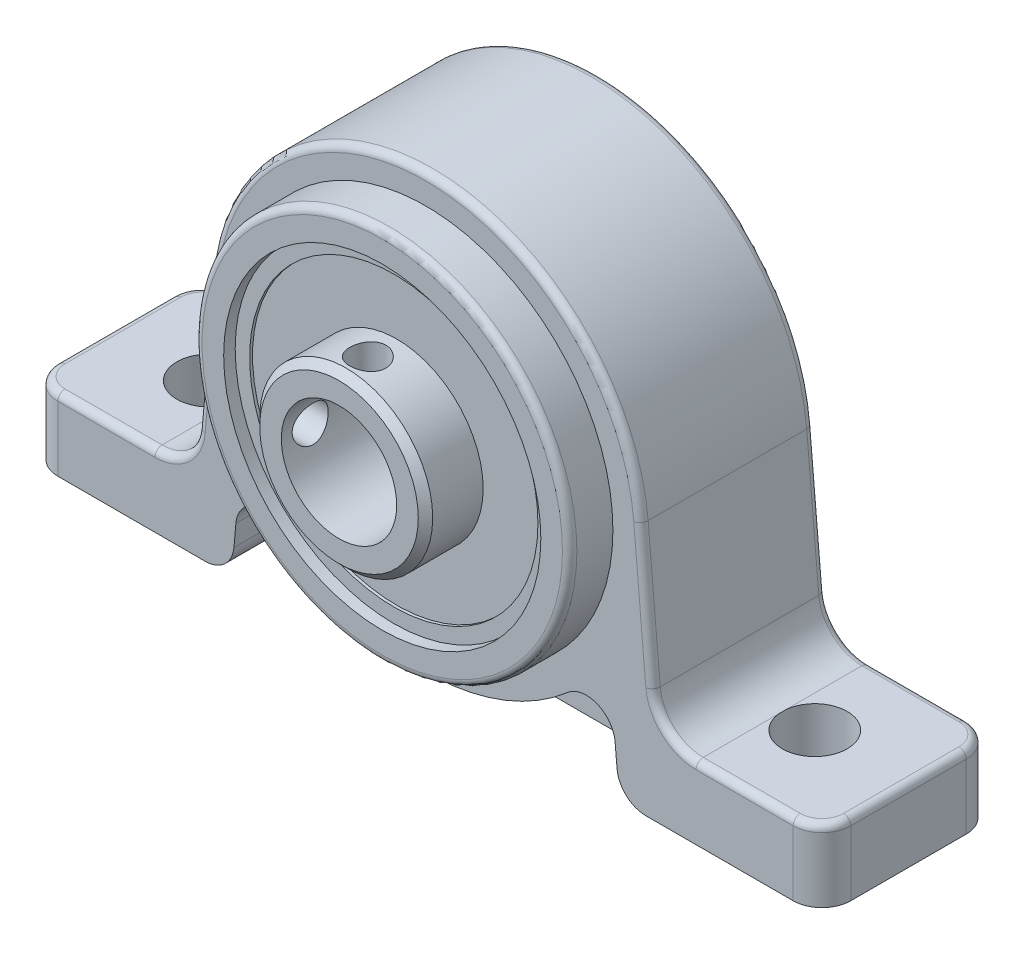
from build123d import *

# Parameters (mm, degrees)
SKETCH1_R           = 13
BOSS_EXTRUDE1_DEPTH = 12
BOSS_EXTRUDE2_START = 3
SKETCH1_3_R         = 13
SKETCH1_3_R_2       = 11
BOSS_EXTRUDE2_DEPTH = 12
BOSS_EXTRUDE3_START = 3.2
SKETCH1_4_R         = 11
SKETCH1_4_R_2       = 10
BOSS_EXTRUDE3_DEPTH = 11
BOSS_EXTRUDE4_START = 3.5
SKETCH1_6_R         = 10
SKETCH1_6_R_2       = 6
BOSS_EXTRUDE4_DEPTH = 10.5
BOSS_EXTRUDE5_START = 3
SKETCH1_7_R         = 6
SKETCH1_7_R_2       = 4
BOSS_EXTRUDE5_DEPTH = 15
SKETCH2_W           = 30.55663803
SKETCH2_H           = 5.5
BOSS_EXTRUDE6_DEPTH = 2
CUT_EXTRUDE1_REACH  = 47.18
SKETCH3_R           = 1.25
CIRPATTERN1_COUNT   = 2
CIRPATTERN1_ANGLE   = 90
FILLET1_R           = 2
FILLET2_R           = 0.5
FILLET3_R           = 1
CHAMFER1_SIZE       = 0.5
SKETCH4_R           = 2.25
CUT_EXTRUDE2_DEPTH  = 42.907636579


with BuildPart() as part:
    # Sketch1 → Boss-Extrude1 (new body)
    with BuildSketch(Plane.XY):
        with BuildLine():
            Line((-27.5, 5), (-27.5, 0))
            Line((-27.5, 0), (-15.278319015, 0))
            ThreePointArc((-15.278319015, 0), (-13.9271386, 0.525445326), (-13.285929619, 1.825688515))
            Line((-13.285929619, 1.825688515), (-13.152529742, 3.35045608))
            ThreePointArc((-13.152529742, 3.35045608), (-11.908837624, 5.030720661), (-9.847182658, 4.684833466))
            ThreePointArc((-9.847182658, 4.684833466), (0, 1), (9.847182658, 4.684833466))
            ThreePointArc((9.847182658, 4.684833466), (11.908837624, 5.030720661), (13.152529742, 3.35045608))
            Line((13.152529742, 3.35045608), (13.285929619, 1.825688515))
            ThreePointArc((13.285929619, 1.825688515), (13.9271386, 0.525445326), (15.278319015, 0))
            Line((15.278319015, 0), (27.5, 0))
            Line((27.5, 0), (27.5, 5))
            Line((27.5, 5), (18.768666384, 5))
            ThreePointArc((18.768666384, 5), (16.741895761, 5.78816799), (15.78008229, 7.738532772))
            Line((15.78008229, 7.738532772), (14.942920471, 17.307336141))
            ThreePointArc((14.942920471, 17.307336141), (0, 31), (-14.942920471, 17.307336141))
            Line((-14.942920471, 17.307336141), (-15.78008229, 7.738532772))
            ThreePointArc((-15.78008229, 7.738532772), (-16.741895761, 5.78816799), (-18.768666384, 5))
            Line((-18.768666384, 5), (-27.5, 5))
        make_face()
        with Locations((0, 16)):
            Circle(SKETCH1_R, mode=Mode.SUBTRACT)
    extrude(amount=BOSS_EXTRUDE1_DEPTH)

    # Sketch1<3> → Boss-Extrude2 (add)
    with BuildSketch(Plane.XY.offset(BOSS_EXTRUDE2_START)):
        with Locations((0, 16)):
            Circle(SKETCH1_3_R)
        with Locations((0, 16)):
            Circle(SKETCH1_3_R_2, mode=Mode.SUBTRACT)
    extrude(amount=BOSS_EXTRUDE2_DEPTH)

    # Sketch1<4> → Boss-Extrude3 (add)
    with BuildSketch(Plane.XY.offset(BOSS_EXTRUDE3_START)):
        with Locations((0, 16)):
            Circle(SKETCH1_4_R)
        with Locations((0, 16)):
            Circle(SKETCH1_4_R_2, mode=Mode.SUBTRACT)
    extrude(amount=BOSS_EXTRUDE3_DEPTH)

    # Sketch1<6> → Boss-Extrude4 (add)
    with BuildSketch(Plane.XY.offset(BOSS_EXTRUDE4_START)):
        with Locations((0, 16)):
            Circle(SKETCH1_6_R)
        with Locations((0, 16)):
            Circle(SKETCH1_6_R_2, mode=Mode.SUBTRACT)
    extrude(amount=BOSS_EXTRUDE4_DEPTH)

    # Sketch1<7> → Boss-Extrude5 (add)
    with BuildSketch(Plane.XY.offset(BOSS_EXTRUDE5_START)):
        with Locations((0, 16)):
            Circle(SKETCH1_7_R)
        with Locations((0, 16)):
            Circle(SKETCH1_7_R_2, mode=Mode.SUBTRACT)
    extrude(amount=BOSS_EXTRUDE5_DEPTH)

    # Sketch2 → Boss-Extrude6 (add, symmetric)
    with BuildSketch(Plane.XY.offset(6)):
        with Locations((0, 2.75)):
            Rectangle(SKETCH2_W, SKETCH2_H)
    extrude(amount=BOSS_EXTRUDE6_DEPTH, both=True)

    # Sketch3 → Cut-Extrude1 (cut, up to next)
    with BuildSketch(Plane(origin=(0, 0, 0), x_dir=(0, 0, -1), z_dir=(1, 0, 0)), mode=Mode.PRIVATE) as cut_extrude1_sk1:
        with Locations((-16, 16)):
            Circle(SKETCH3_R)
    cut_extrude1_tool1 = extrude(cut_extrude1_sk1.sketch, amount=-CUT_EXTRUDE1_REACH, mode=Mode.PRIVATE) & part.part
    cut_extrude1 = cut_extrude1_tool1.solids().sort_by_distance((0, 16, 16))[0]
    add(cut_extrude1, mode=Mode.SUBTRACT)

    # CirPattern1: Cut-Extrude1 ×2 about axis
    cirpattern1_axis = Axis((0, 16, 18), (0, 0, -1))
    for i in range(1, CIRPATTERN1_COUNT):
        add(cut_extrude1.rotate(cirpattern1_axis, i * CIRPATTERN1_ANGLE / (CIRPATTERN1_COUNT - 1)), mode=Mode.SUBTRACT)

    # Fillet1
    fillet1_edges = [part.edges().sort_by_distance(p)[0] for p in [
        (-27.5, 2.5, 0),
        (-27.5, 2.5, 12),
        (27.5, 2.5, 0),
        (27.5, 2.5, 12),
    ]]
    fillet(fillet1_edges, radius=FILLET1_R)

    # Fillet2
    fillet2_edges = [part.edges().sort_by_distance(p)[0] for p in [
        (15.361501381, 12.522934456, 12),
        (16.741895761, 5.78816799, 12),
        (22.134333192, 5, 12),
        (26.914213562, 5, 11.414213562),
        (27.5, 5, 6),
        (26.914213562, 5, 0.585786438),
        (22.134333192, 5, 0),
        (16.741895761, 5.78816799, 0),
        (15.361501381, 12.522934456, 0),
        (0, 31, 0),
        (-15.361501381, 12.522934456, 0),
        (-16.741895761, 5.78816799, 0),
        (-22.134333192, 5, 0),
        (-26.914213562, 5, 0.585786438),
        (-27.5, 5, 6),
        (-26.914213562, 5, 11.414213562),
        (-22.134333192, 5, 12),
        (-16.741895761, 5.78816799, 12),
        (-15.361501381, 12.522934456, 12),
        (0, 31, 12),
        (-13, 16, 15),
    ]]
    fillet(fillet2_edges, radius=FILLET2_R)

    # Fillet3
    fillet3_edges = [part.edges().sort_by_distance(p)[0] for p in [
        (-13, 16, 0),
    ]]
    fillet(fillet3_edges, radius=FILLET3_R)

    # Chamfer1
    chamfer1_edges = [part.edges().sort_by_distance(p)[0] for p in [
        (-6, 16, 18),
    ]]
    chamfer(chamfer1_edges, length=CHAMFER1_SIZE)

    # Sketch4 → Cut-Extrude2 (cut, through all)
    with BuildSketch(Plane(origin=(0, 5, 0), x_dir=(1, 0, 0), z_dir=(0, 1, 0))):
        with Locations((21, -6)):
            Circle(SKETCH4_R)
        with Locations((-21, -6)):
            Circle(SKETCH4_R)
    extrude(amount=-CUT_EXTRUDE2_DEPTH, mode=Mode.SUBTRACT)


solid = part.part
